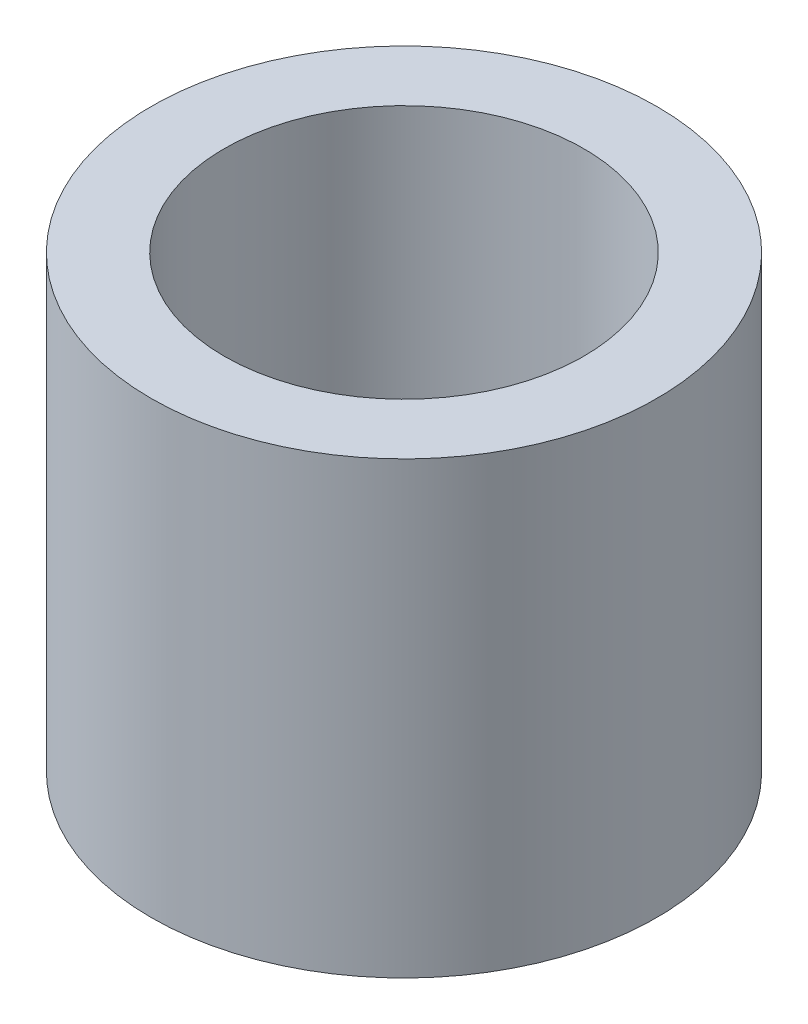
from build123d import *

# Parameters (mm, degrees)
SKETCH1_R           = 2.25
SKETCH1_R_2         = 1.6
BOSS_EXTRUDE1_DEPTH = 4


with BuildPart() as part:
    # Sketch1 → Boss-Extrude1 (new body)
    with BuildSketch(Plane(origin=(0, 0, 0), x_dir=(1, 0, 0), z_dir=(0, 1, 0))):
        with Locations(Location((0, 0, 0), (0, 0, 270))):
            Circle(SKETCH1_R)
        with Locations(Location((0, 0, 0), (0, 0, 270))):
            Circle(SKETCH1_R_2, mode=Mode.SUBTRACT)
    extrude(amount=BOSS_EXTRUDE1_DEPTH)


solid = part.part
